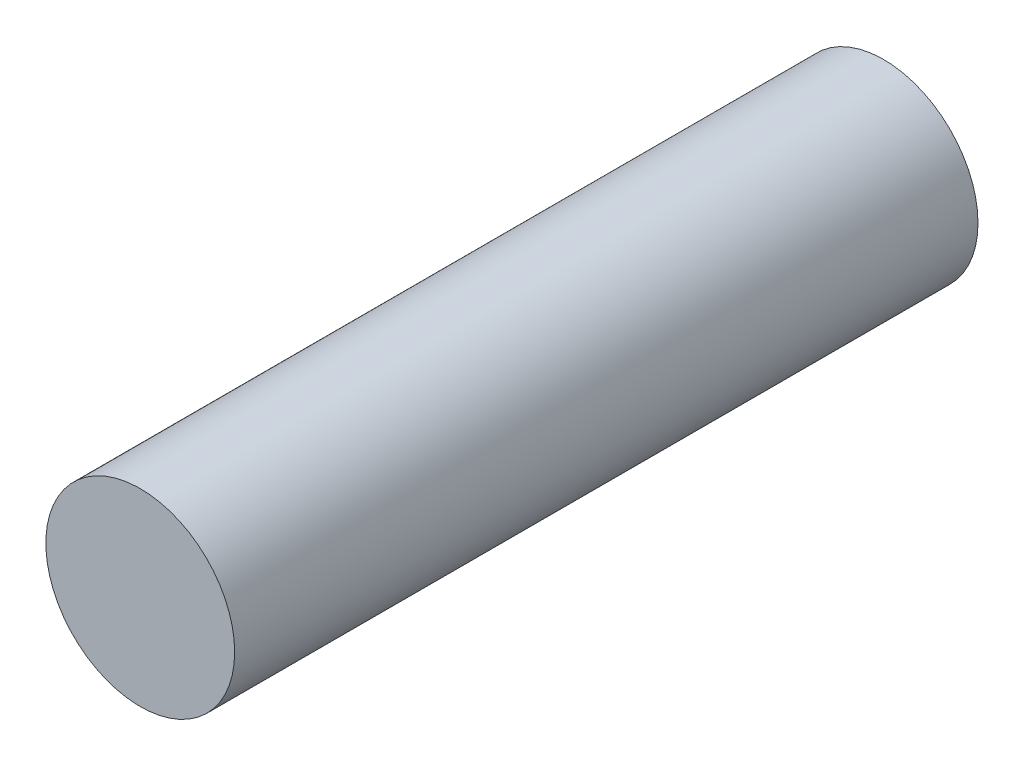
from build123d import *

# Parameters (mm, degrees)
SKETCH1_R           = 6.35
BOSS_EXTRUDE1_DEPTH = 25


with BuildPart() as part:
    # Sketch1 → Boss-Extrude1 (new, symmetric)
    with BuildSketch(Plane.XY):
        Circle(SKETCH1_R)
    extrude(amount=BOSS_EXTRUDE1_DEPTH, both=True)


solid = part.part
